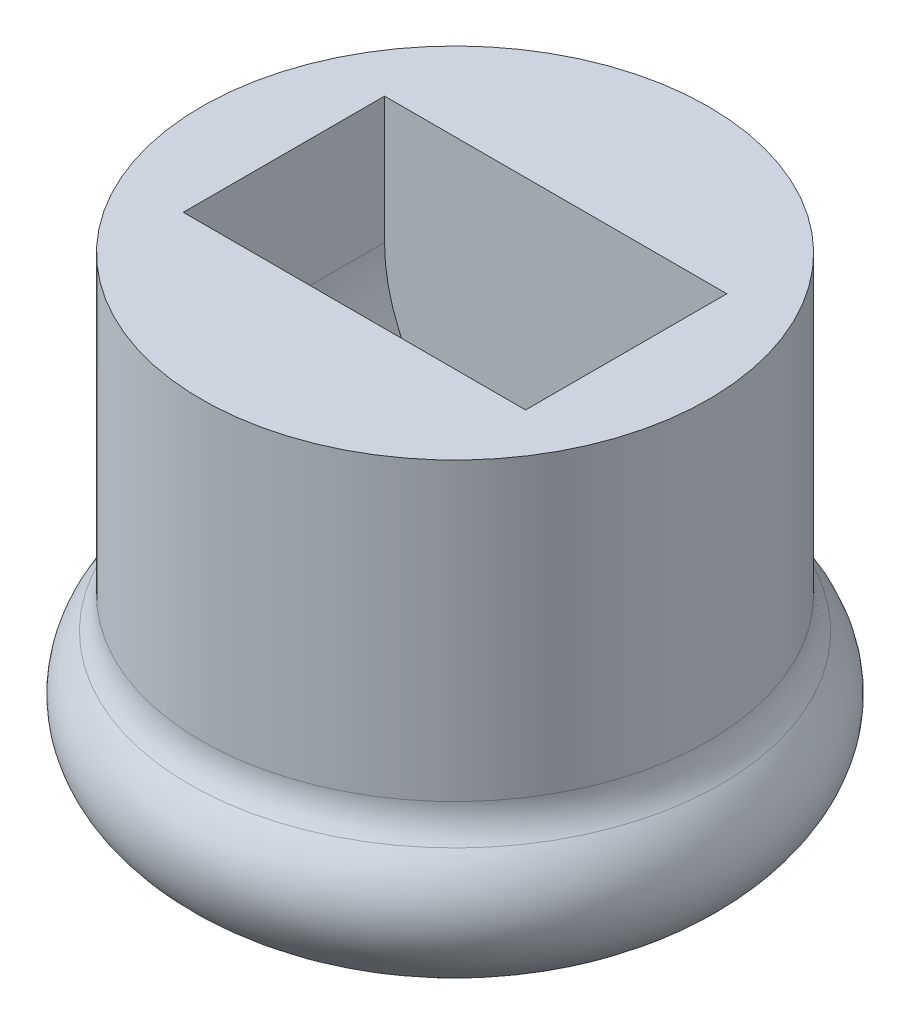
from build123d import *

# Parameters (mm, degrees)
SKETCH2_W          = 5.4
SKETCH2_H          = 3.175
CUT_EXTRUDE1_DEPTH = 2
SKETCH4_R          = 2.7
CUT_EXTRUDE2_DEPTH = 3.175


with BuildPart() as part:
    # Sketch1 → Revolve3 (revolve)
    with BuildSketch(Plane(origin=(0, 0, 0), x_dir=(0, 0, -1), z_dir=(1, 0, 0))):
        with BuildLine():
            Line((4, 1.352218356), (4, 6.017854764))
            Line((4, 6.017854764), (0, 6.017854764))
            Line((0, 6.017854764), (0, -2.176614275))
            add(Edge.make_bspline(
                [(0, -2.176614275), (6.891187287, -2.176614275), (4.190169576, 0.853129288)],
                knots=[1.570796327, 1.570796327, 1.570796327, 3.544345546, 3.544345546, 3.544345546], degree=2, weights=[1, 0.551383512, 1]))
            ThreePointArc((4.190169576, 0.853129288), (4.049153077, 1.085172309), (4, 1.352218356))
        make_face()
    revolve(axis=Axis((0, 6.017854764, 0), (0, 1, 0)))

    # Sketch2 → Cut-Extrude1 (cut)
    with BuildSketch(Plane(origin=(0, 6.017854764, 0), x_dir=(1, 0, 0), z_dir=(0, 1, 0))):
        Rectangle(SKETCH2_W, SKETCH2_H)
    extrude(amount=-CUT_EXTRUDE1_DEPTH, mode=Mode.SUBTRACT)

    # Sketch4 → Cut-Extrude2 (cut)
    with BuildSketch(Plane.XY.offset(-1.5875)):
        with Locations((0, 4.017854764)):
            Circle(SKETCH4_R)
    extrude(amount=CUT_EXTRUDE2_DEPTH, mode=Mode.SUBTRACT)


solid = part.part
